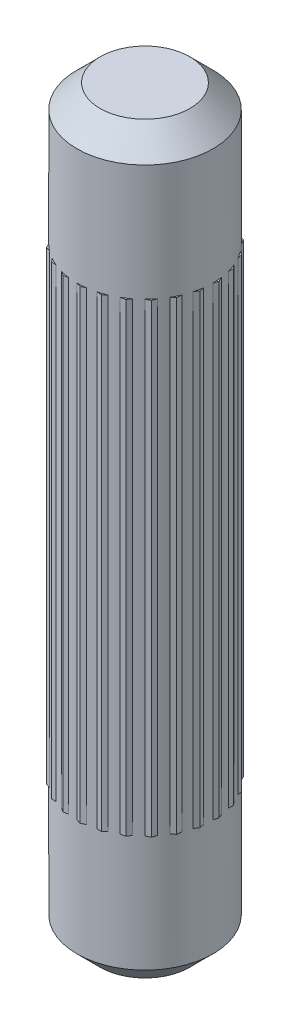
from build123d import *
from build123d.topology import SkipClean

# Parameters (mm, degrees)
SKETCH1_R      = 1.465
EXTRUDE1_DEPTH = 8
CHAMFER1_SIZE  = 0.5
EXTRUDE2_DEPTH = 5


with BuildPart() as part:
    # Sketch1 → Extrude1 (new, symmetric)
    with BuildSketch(Plane(origin=(0, 0, 0), x_dir=(1, 0, 0), z_dir=(0, 1, 0))):
        with Locations(Location((0, 0, 0), (0, 0, 270))):
            Circle(SKETCH1_R)
    extrude(amount=EXTRUDE1_DEPTH, both=True)

    # Chamfer1
    chamfer1_edges = [part.edges().sort_by_distance(p)[0] for p in [
        (0, -8, -1.465),
        (0, 8, -1.465),
    ]]
    chamfer(chamfer1_edges, length=CHAMFER1_SIZE)

    # Sketch2 → Extrude2 (add, symmetric)
    with SkipClean():  # the faces are left unmerged after this step: merging them gives an invalid solid
        with BuildSketch(Plane(origin=(0, 0, 0), x_dir=(1, 0, 0), z_dir=(0, 1, 0))):
            with BuildLine():
                Line((0.191220872, 1.452466722), (0.292635483, 1.471177921))
                Line((0.292635483, 1.471177921), (0.379169901, 1.415081336))
                ThreePointArc((0.379169901, 1.415081336), (0.470908817, 1.38725264), (0.560631228, 1.353483515))
                Line((0.560631228, 1.353483515), (0.663433035, 1.345309112))
                Line((0.663433035, 1.345309112), (0.7325, 1.268727217))
                ThreePointArc((0.7325, 1.268727217), (0.813910391, 1.218102982), (0.891835493, 1.162262644))
                Line((0.891835493, 1.162262644), (0.989018723, 1.127759711))
                Line((0.989018723, 1.127759711), (1.035911434, 1.035911434))
                ThreePointArc((1.035911434, 1.035911434), (1.101445318, 0.965941619), (1.162262644, 0.891835493))
                Line((1.162262644, 0.891835493), (1.247204418, 0.83335535))
                Line((1.247204418, 0.83335535), (1.268727217, 0.7325))
                ThreePointArc((1.268727217, 0.7325), (1.313918566, 0.647952931), (1.353483515, 0.560631228))
                Line((1.353483515, 0.560631228), (1.420395194, 0.482159198))
                Line((1.420395194, 0.482159198), (1.415081336, 0.379169901))
                ThreePointArc((1.415081336, 0.379169901), (1.436850436, 0.285807322), (1.452466722, 0.191220872))
                Line((1.452466722, 0.191220872), (1.496788385, 0.098104694))
                Line((1.496788385, 0.098104694), (1.465, 0))
                ThreePointArc((1.465, 0), (1.461863323, -0.095815584), (1.452466722, -0.191220872))
                Line((1.452466722, -0.191220872), (1.471177921, -0.292635483))
                Line((1.471177921, -0.292635483), (1.415081336, -0.379169901))
                ThreePointArc((1.415081336, -0.379169901), (1.38725264, -0.470908817), (1.353483515, -0.560631228))
                Line((1.353483515, -0.560631228), (1.345309112, -0.663433035))
                Line((1.345309112, -0.663433035), (1.268727217, -0.7325))
                ThreePointArc((1.268727217, -0.7325), (1.218102982, -0.813910391), (1.162262644, -0.891835493))
                Line((1.162262644, -0.891835493), (1.127759711, -0.989018723))
                Line((1.127759711, -0.989018723), (1.035911434, -1.035911434))
                ThreePointArc((1.035911434, -1.035911434), (0.965941619, -1.101445318), (0.891835493, -1.162262644))
                Line((0.891835493, -1.162262644), (0.83335535, -1.247204418))
                Line((0.83335535, -1.247204418), (0.7325, -1.268727217))
                ThreePointArc((0.7325, -1.268727217), (0.647952931, -1.313918566), (0.560631228, -1.353483515))
                Line((0.560631228, -1.353483515), (0.482159198, -1.420395194))
                Line((0.482159198, -1.420395194), (0.379169901, -1.415081336))
                ThreePointArc((0.379169901, -1.415081336), (0.285807322, -1.436850436), (0.191220872, -1.452466722))
                Line((0.191220872, -1.452466722), (0.098104694, -1.496788385))
                Line((0.098104694, -1.496788385), (0, -1.465))
                ThreePointArc((0, -1.465), (-0.095815584, -1.461863323), (-0.191220872, -1.452466722))
                Line((-0.191220872, -1.452466722), (-0.292635483, -1.471177921))
                Line((-0.292635483, -1.471177921), (-0.379169901, -1.415081336))
                ThreePointArc((-0.379169901, -1.415081336), (-0.470908817, -1.38725264), (-0.560631228, -1.353483515))
                Line((-0.560631228, -1.353483515), (-0.663433035, -1.345309112))
                Line((-0.663433035, -1.345309112), (-0.7325, -1.268727217))
                ThreePointArc((-0.7325, -1.268727217), (-0.813910391, -1.218102982), (-0.891835493, -1.162262644))
                Line((-0.891835493, -1.162262644), (-0.989018723, -1.127759711))
                Line((-0.989018723, -1.127759711), (-1.035911434, -1.035911434))
                ThreePointArc((-1.035911434, -1.035911434), (-1.101445318, -0.965941619), (-1.162262644, -0.891835493))
                Line((-1.162262644, -0.891835493), (-1.247204418, -0.83335535))
                Line((-1.247204418, -0.83335535), (-1.268727217, -0.7325))
                ThreePointArc((-1.268727217, -0.7325), (-1.313918566, -0.647952931), (-1.353483515, -0.560631228))
                Line((-1.353483515, -0.560631228), (-1.420395194, -0.482159198))
                Line((-1.420395194, -0.482159198), (-1.415081336, -0.379169901))
                ThreePointArc((-1.415081336, -0.379169901), (-1.436850436, -0.285807322), (-1.452466722, -0.191220872))
                Line((-1.452466722, -0.191220872), (-1.496788385, -0.098104694))
                Line((-1.496788385, -0.098104694), (-1.465, 0))
                ThreePointArc((-1.465, 0), (-1.461863323, 0.095815584), (-1.452466722, 0.191220872))
                Line((-1.452466722, 0.191220872), (-1.471177921, 0.292635483))
                Line((-1.471177921, 0.292635483), (-1.415081336, 0.379169901))
                ThreePointArc((-1.415081336, 0.379169901), (-1.38725264, 0.470908817), (-1.353483515, 0.560631228))
                Line((-1.353483515, 0.560631228), (-1.345309112, 0.663433035))
                Line((-1.345309112, 0.663433035), (-1.268727217, 0.7325))
                ThreePointArc((-1.268727217, 0.7325), (-1.218102982, 0.813910391), (-1.162262644, 0.891835493))
                Line((-1.162262644, 0.891835493), (-1.127759711, 0.989018723))
                Line((-1.127759711, 0.989018723), (-1.035911434, 1.035911434))
                ThreePointArc((-1.035911434, 1.035911434), (-0.965941619, 1.101445318), (-0.891835493, 1.162262644))
                Line((-0.891835493, 1.162262644), (-0.83335535, 1.247204418))
                Line((-0.83335535, 1.247204418), (-0.7325, 1.268727217))
                ThreePointArc((-0.7325, 1.268727217), (-0.647952931, 1.313918566), (-0.560631228, 1.353483515))
                Line((-0.560631228, 1.353483515), (-0.482159198, 1.420395194))
                Line((-0.482159198, 1.420395194), (-0.379169901, 1.415081336))
                ThreePointArc((-0.379169901, 1.415081336), (-0.285807322, 1.436850436), (-0.191220872, 1.452466722))
                Line((-0.191220872, 1.452466722), (-0.098104694, 1.496788385))
                Line((-0.098104694, 1.496788385), (0, 1.465))
                ThreePointArc((0, 1.465), (0.095815584, 1.461863323), (0.191220872, 1.452466722))
            make_face()
        extrude(amount=EXTRUDE2_DEPTH, both=True)


solid = part.part
